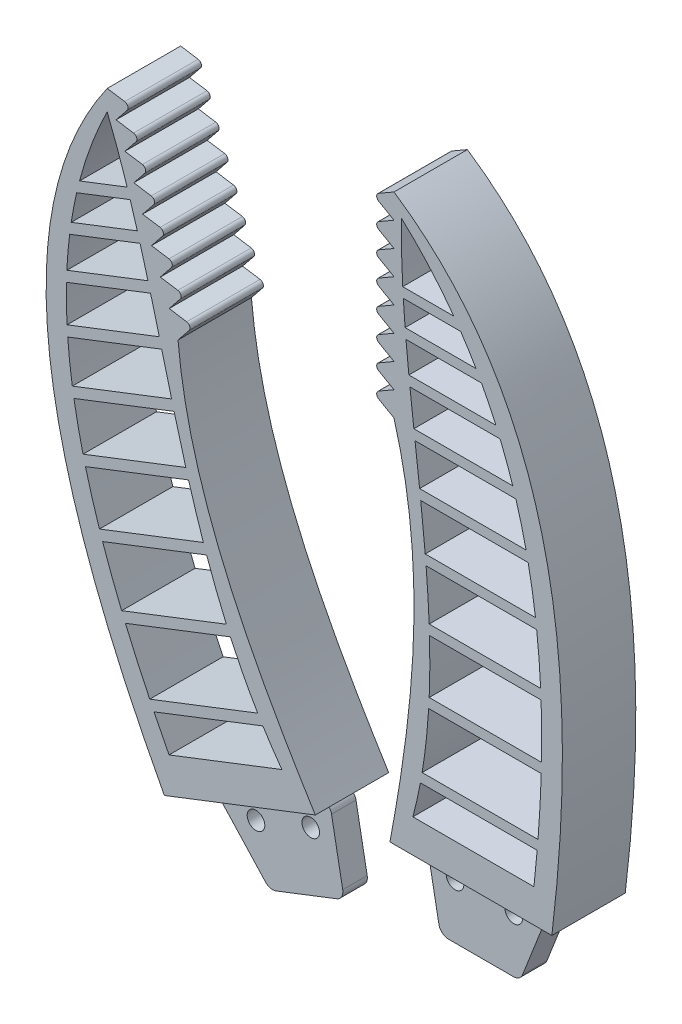
from build123d import *

# Parameters (mm, degrees)
SKETCH_2_R      = 1.8
EXTRUDE_1_DEPTH = 5
EXTRUDE_2_DEPTH = 15
SKETCH_5_W      = 13.682292861
SKETCH_5_H      = 2
SKETCH_5_W_2    = 18.596355789
SKETCH_5_W_3    = 21.922878645
SKETCH_5_W_4    = 24.391406535
SKETCH_5_W_5    = 25.26949717
SKETCH_5_W_6    = 25.12106125
SKETCH_5_W_7    = 27.150521786
SKETCH_5_W_8    = 26.787845666
SKETCH_5_W_9    = 26.908070373
EXTRUDE_5_DEPTH = 15


with BuildPart() as part:
    # 草图2 → 凸台-拉伸1 (new body)
    with BuildSketch(Plane.XY):
        with BuildLine():
            Line((1.660431991, 0), (14.915948235, 0))
            ThreePointArc((14.915948235, 0), (16.042856147, 0.347705063), (16.777932472, 1.269921443))
            Line((16.777932472, 1.269921443), (21.569358625, 13.489921443))
            ThreePointArc((21.569358625, 13.489921443), (21.359669324, 15.346907912), (19.707374388, 16.22))
            Line((19.707374388, 16.22), (-0.626478849, 16.22))
            ThreePointArc((-0.626478849, 16.22), (-2.165277959, 15.497535635), (-2.592349547, 13.852097299))
            Line((-2.592349547, 13.852097299), (-0.305438707, 1.632097299))
            ThreePointArc((-0.305438707, 1.632097299), (0.382896356, 0.46120089), (1.660431991, 0))
        make_face()
        with Locations((2.987038617, 11.22)):
            Circle(SKETCH_2_R, mode=Mode.SUBTRACT)
        with Locations((14.987038617, 11.22)):
            Circle(SKETCH_2_R, mode=Mode.SUBTRACT)
    extrude(amount=EXTRUDE_1_DEPTH)

    # 草图3 → 凸台-拉伸2 (add)
    with BuildSketch(Plane(origin=(0, 0, -5), x_dir=(-1, 0, 0), z_dir=(0, 0, -1))):
        with BuildLine():
            Line((0.626478849, 16.22), (-27.772557769, 16.22))
            add(Edge.make_bspline(
                [(-27.772557769, 16.22), (-32.493161142, 55.467514505), (-32.453573251, 107.077187546), (4.491826918, 131.663635033)],
                knots=[0, 0, 0, 0, 1, 1, 1, 1], degree=3))
            Line((4.491826918, 131.663635033), (7.621953937, 129.856455356))
            ThreePointArc((7.621953937, 129.856455356), (8.021953937, 129.163635033), (7.621953937, 128.47081471))
            Line((7.621953937, 128.47081471), (4.491826918, 126.663635033))
            Line((4.491826918, 126.663635033), (7.621953937, 124.856455356))
            ThreePointArc((7.621953937, 124.856455356), (8.021953937, 124.163635033), (7.621953937, 123.47081471))
            Line((7.621953937, 123.47081471), (4.491826918, 121.663635033))
            Line((4.491826918, 121.663635033), (7.621953937, 119.856455356))
            ThreePointArc((7.621953937, 119.856455356), (8.021953937, 119.163635033), (7.621953937, 118.47081471))
            Line((7.621953937, 118.47081471), (4.491826918, 116.663635033))
            Line((4.491826918, 116.663635033), (7.621953937, 114.856455356))
            ThreePointArc((7.621953937, 114.856455356), (8.021953937, 114.163635033), (7.621953937, 113.47081471))
            Line((7.621953937, 113.47081471), (4.491826918, 111.663635033))
            Line((4.491826918, 111.663635033), (7.621953937, 109.856455356))
            ThreePointArc((7.621953937, 109.856455356), (8.021953937, 109.163635033), (7.621953937, 108.47081471))
            Line((7.621953937, 108.47081471), (4.491826918, 106.663635033))
            Line((4.491826918, 106.663635033), (7.621953937, 104.856455356))
            ThreePointArc((7.621953937, 104.856455356), (8.021953937, 104.163635033), (7.621953937, 103.47081471))
            Line((7.621953937, 103.47081471), (4.491826918, 101.663635033))
            Line((4.491826918, 101.663635033), (7.621953937, 99.856455356))
            ThreePointArc((7.621953937, 99.856455356), (8.021953937, 99.163635033), (7.621953937, 98.47081471))
            Line((7.621953937, 98.47081471), (4.491826918, 96.663635033))
            Line((4.491826918, 96.663635033), (7.621953937, 94.856455356))
            ThreePointArc((7.621953937, 94.856455356), (8.021953937, 94.163635033), (7.621953937, 93.47081471))
            Line((7.621953937, 93.47081471), (4.491826918, 91.663635033))
            add(Edge.make_bspline(
                [(4.491826918, 91.663635033), (-2.585061361, 67.200896114), (0.71837459, 40.719953967), (5.318915354, 16.22)],
                knots=[0, 0, 0, 0, 1, 1, 1, 1], degree=3))
            Line((5.318915354, 16.22), (0.626478849, 16.22))
        make_face()
        with BuildLine():
            Line((-24.103793947, 23.010859877), (0.626478849, 23.010859877))
            add(Edge.make_bspline(
                [(2.973465528, 127.797233808), (3.481169221, 92.796148939), (-8.560841365, 57.819257989), (0.626478849, 23.010859877)],
                knots=[0, 0, 0, 0, 1, 1, 1, 1], degree=3))
            add(Edge.make_bspline(
                [(-24.103793947, 23.010859877), (-28.090714091, 59.372707402), (-26.469023658, 100.897982042), (2.973465528, 127.797233808)],
                knots=[0, 0, 0, 0, 1, 1, 1, 1], degree=3))
        make_face(mode=Mode.SUBTRACT)
    extrude(amount=-EXTRUDE_2_DEPTH)

    # 草图5 → 凸台-拉伸5 (add)
    with BuildSketch(Plane(origin=(0, 0, -5), x_dir=(-1, 0, 0), z_dir=(0, 0, -1))):
        with Locations((-3.543748894, 114.797233808)):
            Rectangle(SKETCH_5_W, SKETCH_5_H)
        with Locations((-6.000780358, 107.797233808)):
            Rectangle(SKETCH_5_W_2, SKETCH_5_H)
        with Locations((-8.088275734, 99.797233808)):
            Rectangle(SKETCH_5_W_3, SKETCH_5_H)
        with Locations((-9.557637573, 90.797233808)):
            Rectangle(SKETCH_5_W_4, SKETCH_5_H)
        with Locations((-11.423697723, 80.797233808)):
            Rectangle(SKETCH_5_W_5, SKETCH_5_H)
        with Locations((-12.286182518, 69.797233808)):
            Rectangle(SKETCH_5_W_6, SKETCH_5_H)
        with Locations((-13.575260893, 57.797233808)):
            Rectangle(SKETCH_5_W_7, SKETCH_5_H)
        with Locations((-13.756598953, 44.797233808)):
            Rectangle(SKETCH_5_W_8, SKETCH_5_H)
        with Locations((-13.17968708, 30.797233808)):
            Rectangle(SKETCH_5_W_9, SKETCH_5_H)
    extrude(amount=-EXTRUDE_5_DEPTH)


with BuildPart() as body_2:
    # 镜向3: mirrored copy
    add(part.part.mirror(Plane(origin=(-9.829353491, -1.839513506, 0), x_dir=(0, 0, 1), z_dir=(-0.9829353491495536, -0.18395135061272394, 0))))


solid = Compound([part.part, body_2.part])
